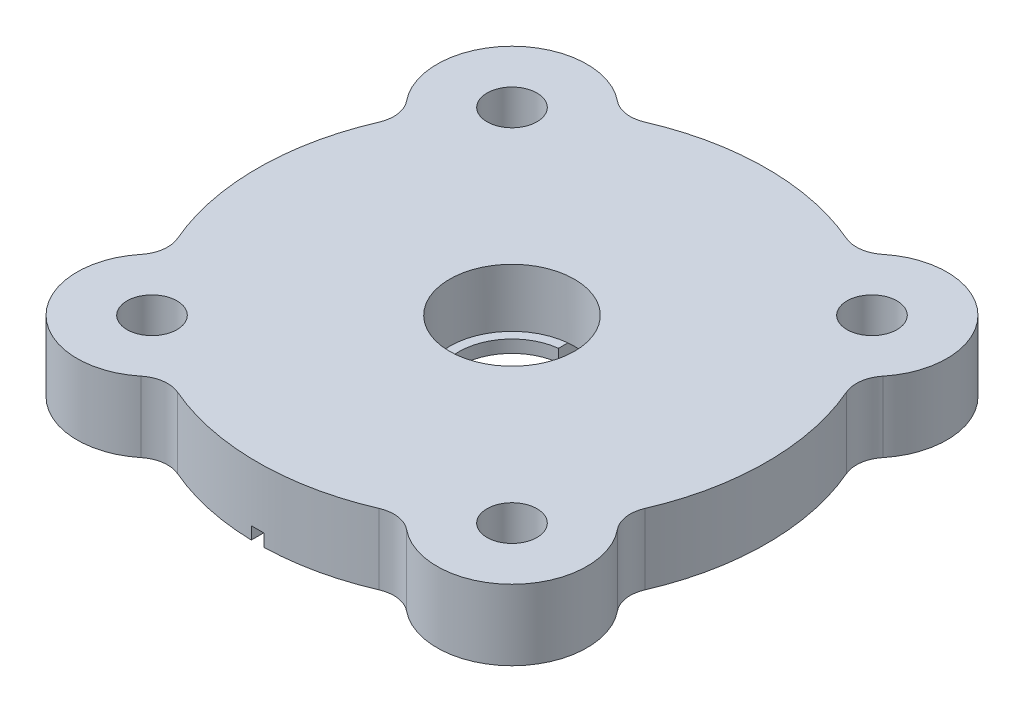
from build123d import *

# Parameters (mm, degrees)
SKETCH1_R                 = 4
SKETCH1_R_2               = 8.5
BODY_AND_MAIN_HOLES_DEPTH = 11.3
SKETCH3_R                 = 10
SEAL_BORE_DEPTH           = 9.3
SKETCH4_W                 = 2
SKETCH4_H                 = 81.5
CUT_EXTRUDE1_DEPTH        = 2


with BuildPart() as part:
    # Sketch1 → body and main holes (new body)
    with BuildSketch(Plane(origin=(0, 0, 0), x_dir=(1, 0, 0), z_dir=(0, 1, 0))):
        with BuildLine():
            ThreePointArc((-21.253798436, 38.13309153), (-37.299882708, 37.299882708), (-38.13309153, 21.253798436))
            ThreePointArc((-38.13309153, 21.253798436), (-37.062920165, 18.788316543), (-37.42390553, 16.124943252))
            ThreePointArc((-37.42390553, 16.124943252), (-40.75, 0), (-37.42390553, -16.124943252))
            ThreePointArc((-37.42390553, -16.124943252), (-37.062920165, -18.788316543), (-38.13309153, -21.253798436))
            ThreePointArc((-38.13309153, -21.253798436), (-37.299882708, -37.299882708), (-21.253798436, -38.13309153))
            ThreePointArc((-21.253798436, -38.13309153), (-18.788316543, -37.062920165), (-16.124943252, -37.42390553))
            ThreePointArc((-16.124943252, -37.42390553), (0, -40.75), (16.124943252, -37.42390553))
            ThreePointArc((16.124943252, -37.42390553), (18.788316543, -37.062920165), (21.253798436, -38.13309153))
            ThreePointArc((21.253798436, -38.13309153), (37.299882708, -37.299882708), (38.13309153, -21.253798436))
            ThreePointArc((38.13309153, -21.253798436), (37.062920165, -18.788316543), (37.42390553, -16.124943252))
            ThreePointArc((37.42390553, -16.124943252), (40.75, 0), (37.42390553, 16.124943252))
            ThreePointArc((37.42390553, 16.124943252), (37.062920165, 18.788316543), (38.13309153, 21.253798436))
            ThreePointArc((38.13309153, 21.253798436), (37.299882708, 37.299882708), (21.253798436, 38.13309153))
            ThreePointArc((21.253798436, 38.13309153), (18.788316543, 37.062920165), (16.124943252, 37.42390553))
            ThreePointArc((16.124943252, 37.42390553), (0, 40.75), (-16.124943252, 37.42390553))
            ThreePointArc((-16.124943252, 37.42390553), (-18.788316543, 37.062920165), (-21.253798436, 38.13309153))
        make_face()
        with Locations(Location((-28.814601333, 28.814601333, 0), (0, 0, 270))):
            Circle(SKETCH1_R, mode=Mode.SUBTRACT)
        with Locations(Location((28.814601333, 28.814601333, 0), (0, 0, 270))):
            Circle(SKETCH1_R, mode=Mode.SUBTRACT)
        with Locations(Location((28.814601333, -28.814601333, 0), (0, 0, 270))):
            Circle(SKETCH1_R, mode=Mode.SUBTRACT)
        with Locations(Location((-28.814601333, -28.814601333, 0), (0, 0, 270))):
            Circle(SKETCH1_R, mode=Mode.SUBTRACT)
        with Locations(Location((0, 0, 0), (0, 0, 270))):
            Circle(SKETCH1_R_2, mode=Mode.SUBTRACT)
    extrude(amount=BODY_AND_MAIN_HOLES_DEPTH)

    # Sketch3 → seal bore (cut)
    with BuildSketch(Plane.XZ.offset(-11.3)):
        with Locations(Location((0, 0, 0), (0, 0, 270))):
            Circle(SKETCH3_R)
    extrude(amount=SEAL_BORE_DEPTH, mode=Mode.SUBTRACT)

    # Sketch4 → Cut-Extrude1 (cut)
    with BuildSketch(Plane.XZ):
        Rectangle(SKETCH4_W, SKETCH4_H)
    extrude(amount=-CUT_EXTRUDE1_DEPTH, mode=Mode.SUBTRACT)


solid = part.part
